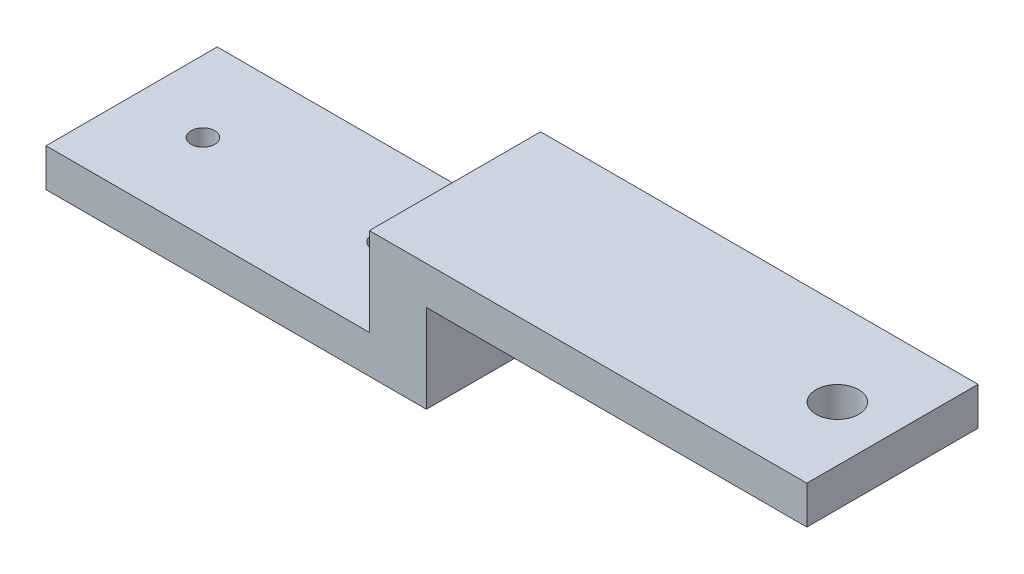
from build123d import *

# Parameters (mm, degrees)
BOSS_EXTRUDE1_DEPTH = 36
SKETCH2_R           = 4.5
CUT_EXTRUDE1_DEPTH  = 30
SKETCH3_R           = 2.5
CUT_EXTRUDE2_DEPTH  = 10


with BuildPart() as part:
    # Sketch1 → Boss-Extrude1 (new body)
    with BuildSketch(Plane.XY):
        Polygon((-123.814545152, -26.546784039), (-43.814545152, -26.546784039), (-43.814545152, -15.688919663), (-43.814545152, -8), (-29.603926395, -8), (0.496524767, -8), (36.185454848, -8), (36.185454848, 0), (-33.18939726, 0), (-55.814545152, 0), (-55.814545152, -18.546784039), (-123.814545152, -18.546784039), align=None)
    extrude(amount=BOSS_EXTRUDE1_DEPTH)

    # Sketch2 → Cut-Extrude1 (cut)
    with BuildSketch(Plane(origin=(0, 0, 0), x_dir=(1, 0, 0), z_dir=(0, 1, 0))):
        with Locations(Location((24.611399957, -18, 0), (0, 0, 180))):
            Circle(SKETCH2_R)
    extrude(amount=-CUT_EXTRUDE1_DEPTH, mode=Mode.SUBTRACT)

    # Sketch3 → Cut-Extrude2 (cut)
    with BuildSketch(Plane(origin=(0, -18.546784039, 0), x_dir=(1, 0, 0), z_dir=(0, 1, 0))):
        with Locations(Location((-108.814545152, -18, 0), (0, 0, 270))):
            Circle(SKETCH3_R)
        with Locations(Location((-70.814545152, -18, 0), (0, 0, 270))):
            Circle(SKETCH3_R)
    extrude(amount=-CUT_EXTRUDE2_DEPTH, mode=Mode.SUBTRACT)


solid = part.part
